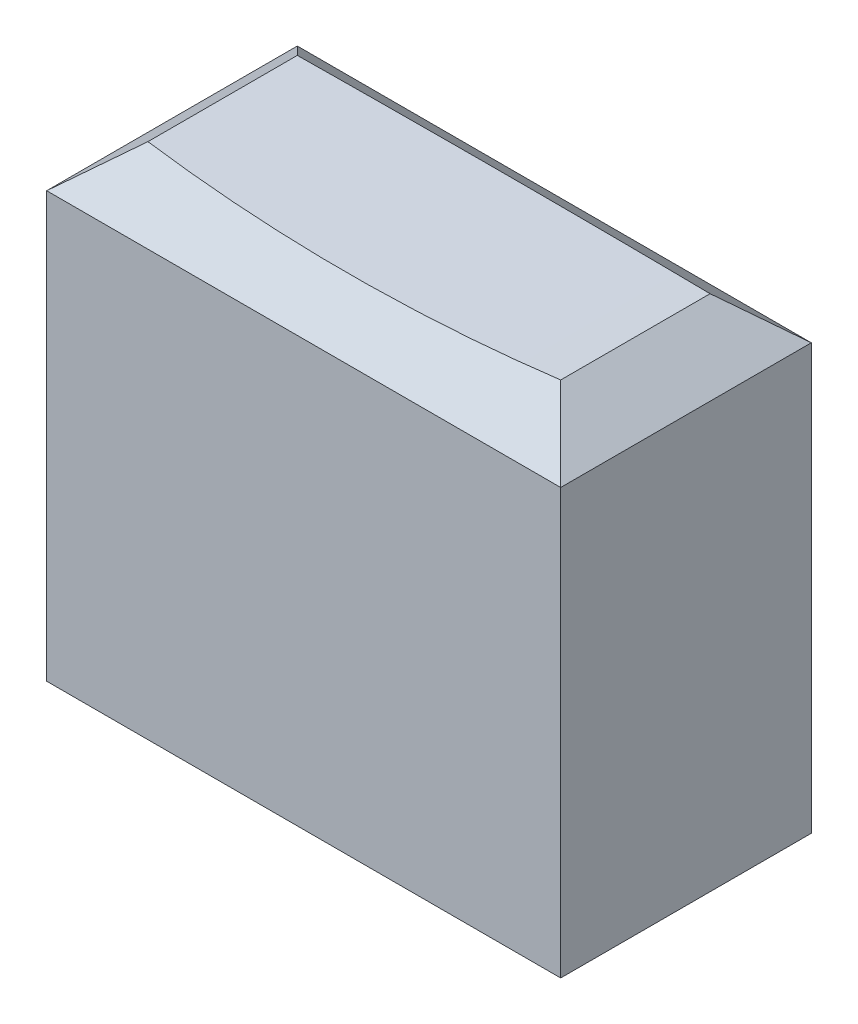
from build123d import *
from OCP.BRepFilletAPI import BRepFilletAPI_MakeChamfer

# Parameters (mm, degrees)
SKETCH1_W           = 12.1
SKETCH1_H           = 5.9
BOSS_EXTRUDE1_DEPTH = 11
CHAMFER1_SIZE       = 1
CHAMFER1_SIZE2      = 1.191753593
CUT_EXTRUDE3_DEPTH  = 14.871283286
CUT_EXTRUDE4_DEPTH  = 9


with BuildPart() as part:
    # Sketch1 → Boss-Extrude1 (new body)
    with BuildSketch(Plane(origin=(0, 0, 0), x_dir=(1, 0, 0), z_dir=(0, 1, 0))):
        Rectangle(SKETCH1_W, SKETCH1_H)
    extrude(amount=BOSS_EXTRUDE1_DEPTH)

    # Chamfer1: one chamfer whose edges measure the first distance from different faces: ONE call of the kernel's chamfer builder (chamfer() names one face for all edges)
    chamfer1_edges_1 = [part.edges().sort_by_distance(p)[0] for p in [
        (6.05, 11, 0),
    ]]
    chamfer1_side_1 = [part.faces().sort_by_distance(p)[0] for p in [
        (6.05, 5.5, 0),
    ]]
    chamfer1_edges_2 = [part.edges().sort_by_distance(p)[0] for p in [
        (0, 11, -2.95),
    ]]
    chamfer1_side_2 = [part.faces().sort_by_distance(p)[0] for p in [
        (0, 5.5, -2.95),
    ]]
    chamfer1_edges_3 = [part.edges().sort_by_distance(p)[0] for p in [
        (-6.05, 11, 0),
    ]]
    chamfer1_side_3 = [part.faces().sort_by_distance(p)[0] for p in [
        (-6.05, 5.5, 0),
    ]]
    chamfer1_edges_4 = [part.edges().sort_by_distance(p)[0] for p in [
        (0, 11, 2.95),
    ]]
    chamfer1_side_4 = [part.faces().sort_by_distance(p)[0] for p in [
        (0, 5.5, 2.95),
    ]]
    chamfer1 = BRepFilletAPI_MakeChamfer(part.part.solid().wrapped)
    for e in chamfer1_edges_1:
        chamfer1.Add(CHAMFER1_SIZE, CHAMFER1_SIZE2, e.wrapped, chamfer1_side_1[0].wrapped)  # the first distance lies on this face
    for e in chamfer1_edges_2:
        chamfer1.Add(CHAMFER1_SIZE, CHAMFER1_SIZE2, e.wrapped, chamfer1_side_2[0].wrapped)  # the first distance lies on this face
    for e in chamfer1_edges_3:
        chamfer1.Add(CHAMFER1_SIZE, CHAMFER1_SIZE2, e.wrapped, chamfer1_side_3[0].wrapped)  # the first distance lies on this face
    for e in chamfer1_edges_4:
        chamfer1.Add(CHAMFER1_SIZE, CHAMFER1_SIZE2, e.wrapped, chamfer1_side_4[0].wrapped)  # the first distance lies on this face
    add(Compound.cast(chamfer1.Shape()), mode=Mode.REPLACE)

    # Sketch6 → Cut-Extrude3 (cut, through all)
    with BuildSketch(Plane.XY.offset(2.95)):
        with BuildLine():
            Line((-4.858246407, 11), (4.858246407, 11))
            ThreePointArc((4.858246407, 11), (0, 10.85), (-4.858246407, 11))
        make_face()
    extrude(amount=-CUT_EXTRUDE3_DEPTH, mode=Mode.SUBTRACT)

    # Sketch7 → Cut-Extrude4 (cut)
    with BuildSketch(Plane.XZ):
        Polygon((-2.05, -1), (-2.05, -2.45), (-5.55, -2.45), (-5.55, 2.45), (-2.05, 2.45), (-2.05, 1), (-1.65, 1), (-1.65, 1.65), (1.65, 1.65), (1.65, 1), (2.05, 1), (2.05, 2.45), (5.55, 2.45), (5.55, -2.45), (2.05, -2.45), (2.05, -1), (1.65, -1), (1.65, -1.65), (-1.65, -1.65), (-1.65, -1), align=None)
    extrude(amount=-CUT_EXTRUDE4_DEPTH, mode=Mode.SUBTRACT)


solid = part.part
